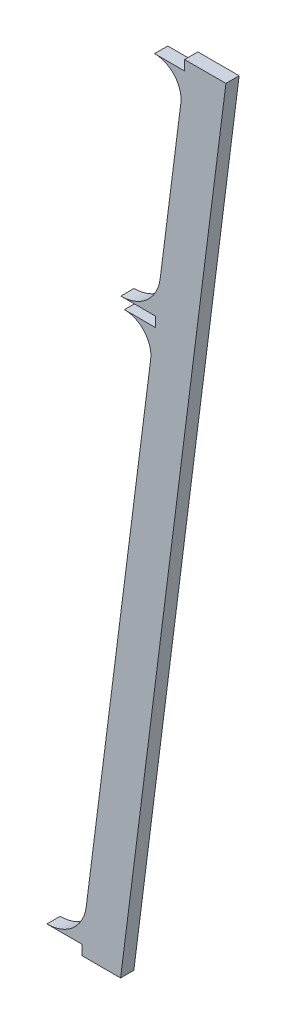
from build123d import *

# Parameters (mm, degrees)
EXTRUDE_1_DEPTH = 2


with BuildPart() as part:
    # 草图1 → 凸台-拉伸1 (new body)
    with BuildSketch(Plane.XY):
        with BuildLine():
            Line((32.521472611, 127.716716237), (26.282107631, 127.716716237))
            Line((26.282107631, 127.716716237), (26.282107631, 126.216716237))
            Line((26.282107631, 126.216716237), (21.740638301, 126.216716237))
            ThreePointArc((21.740638301, 126.216716237), (24.74234251, 124.860533901), (25.708617606, 121.711602158))
            Line((25.708617606, 121.711602158), (22.586955956, 97.189045118))
            ThreePointArc((22.586955956, 97.189045118), (20.600713495, 93.444159924), (16.634986998, 91.946716237))
            Line((16.634986998, 91.946716237), (21.919620287, 91.946716237))
            Line((21.919620287, 91.946716237), (21.919620287, 90.446716237))
            Line((21.919620287, 90.446716237), (17.187204618, 90.446716237))
            ThreePointArc((17.187204618, 90.446716237), (20.188908827, 89.090533901), (21.155183923, 85.941602158))
            Line((21.155183923, 85.941602158), (11.419141111, 9.459045118))
            ThreePointArc((11.419141111, 9.459045118), (9.43289865, 5.714159924), (5.467172154, 4.216716237))
            Line((5.467172154, 4.216716237), (10.751805442, 4.216716237))
            Line((10.751805442, 4.216716237), (10.751805442, 2.716716237))
            Line((10.751805442, 2.716716237), (16.609277745, 2.716716237))
            Line((16.609277745, 2.716716237), (32.521472611, 127.716716237))
        make_face()
    extrude(amount=EXTRUDE_1_DEPTH)


solid = part.part
